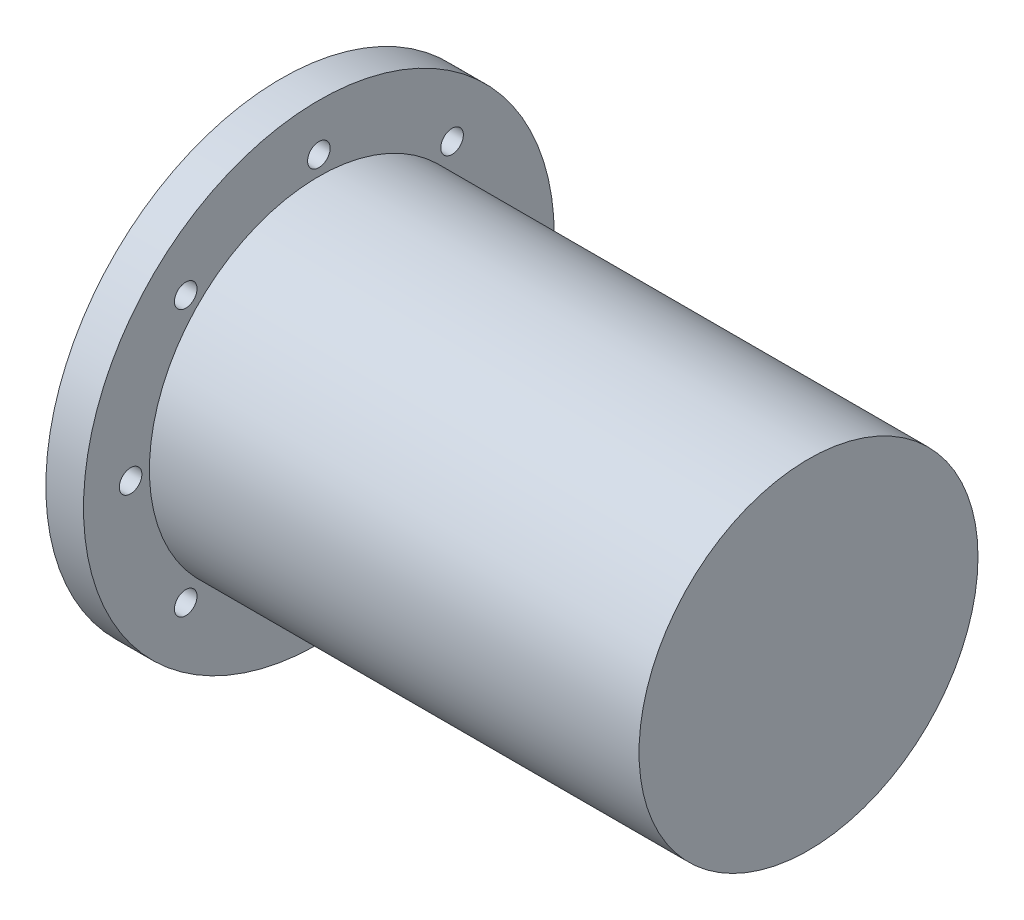
from build123d import *

# Parameters (mm, degrees)
CROQUIS1_R              = 125
CROQUIS1_R_2            = 6
SALIENTE_EXTRUIR1_DEPTH = 20
CROQUIS2_R              = 90
SALIENTE_EXTRUIR2_DEPTH = 260


with BuildPart() as part:
    # Croquis1 → Saliente-Extruir1 (new body)
    with BuildSketch(Plane(origin=(0, 0, 0), x_dir=(0, 0, -1), z_dir=(1, 0, 0))):
        Circle(CROQUIS1_R)
        with Locations((0, -100)):
            Circle(CROQUIS1_R_2, mode=Mode.SUBTRACT)
        with Locations((-70.710678119, -70.710678119)):
            Circle(CROQUIS1_R_2, mode=Mode.SUBTRACT)
        with Locations((-100, 0)):
            Circle(CROQUIS1_R_2, mode=Mode.SUBTRACT)
        with Locations((-70.710678119, 70.710678119)):
            Circle(CROQUIS1_R_2, mode=Mode.SUBTRACT)
        with Locations((0, 100)):
            Circle(CROQUIS1_R_2, mode=Mode.SUBTRACT)
        with Locations((70.710678119, 70.710678119)):
            Circle(CROQUIS1_R_2, mode=Mode.SUBTRACT)
        with Locations((100, 0)):
            Circle(CROQUIS1_R_2, mode=Mode.SUBTRACT)
        with Locations((70.710678119, -70.710678119)):
            Circle(CROQUIS1_R_2, mode=Mode.SUBTRACT)
    extrude(amount=SALIENTE_EXTRUIR1_DEPTH)

    # Croquis2 → Saliente-Extruir2 (add)
    with BuildSketch(Plane(origin=(20, 0, 0), x_dir=(0, 0, -1), z_dir=(1, 0, 0))):
        Circle(CROQUIS2_R)
    extrude(amount=SALIENTE_EXTRUIR2_DEPTH)


solid = part.part
